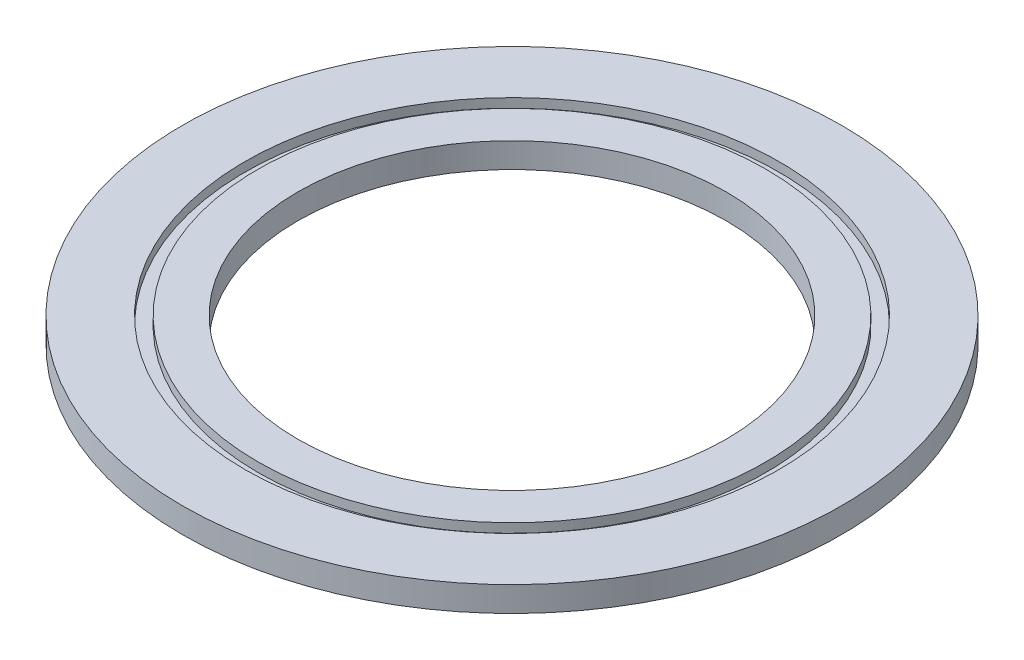
from build123d import *

# Parameters (mm, degrees)
SKETCH1_R           = 250
SKETCH1_R_2         = 162.5
BOSS_EXTRUDE1_DEPTH = 9.5
SKETCH2_R           = 202.5
SKETCH2_R_2         = 192.5
CUT_EXTRUDE1_DEPTH  = 7


with BuildPart() as part:
    # Sketch1 → Boss-Extrude1 (new, symmetric)
    with BuildSketch(Plane(origin=(0, 0, 0), x_dir=(1, 0, 0), z_dir=(0, 1, 0))):
        with Locations(Location((0, 0, 0), (0, 0, 270))):
            Circle(SKETCH1_R)
        with Locations(Location((0, 0, 0), (0, 0, 270))):
            Circle(SKETCH1_R_2, mode=Mode.SUBTRACT)
    extrude(amount=BOSS_EXTRUDE1_DEPTH, both=True)

    # Sketch2 → Cut-Extrude1 (cut)
    with BuildSketch(Plane(origin=(0, 9.5, 0), x_dir=(1, 0, 0), z_dir=(0, 1, 0))):
        with Locations(Location((0, 0, 0), (0, 0, 270))):
            Circle(SKETCH2_R)
        with Locations(Location((0, 0, 0), (0, 0, 270))):
            Circle(SKETCH2_R_2, mode=Mode.SUBTRACT)
    extrude(amount=-CUT_EXTRUDE1_DEPTH, mode=Mode.SUBTRACT)


solid = part.part
